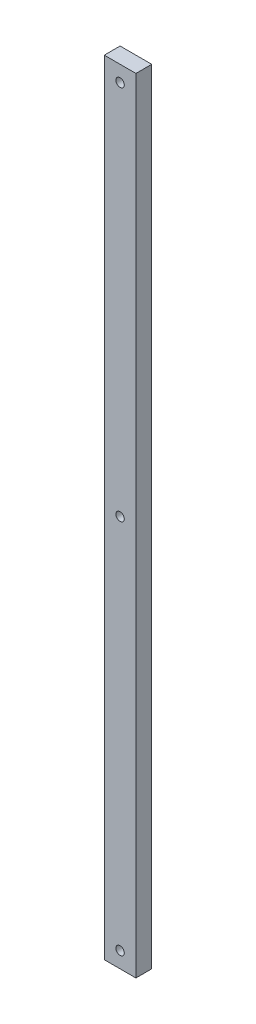
from build123d import *

# Parameters (mm, degrees)
SKETCH1_W           = 25.4
SKETCH1_H           = 628.65
BOSS_EXTRUDE1_DEPTH = 12.7
SKETCH2_R           = 3.3655
CUT_EXTRUDE1_DEPTH  = 630.291087256
LPATTERN1_COUNT     = 3
LPATTERN1_PITCH     = 301.625


with BuildPart() as part:
    # Sketch1 → Boss-Extrude1 (new body)
    with BuildSketch(Plane.XY):
        with Locations((-12.7, 314.325)):
            Rectangle(SKETCH1_W, SKETCH1_H)
    extrude(amount=BOSS_EXTRUDE1_DEPTH)

    # Sketch2 → Cut-Extrude1 (cut, through all)
    with BuildSketch(Plane.XY.offset(12.7)):
        with Locations((-12.7, 12.7)):
            Circle(SKETCH2_R)
    cut_extrude1 = extrude(amount=-CUT_EXTRUDE1_DEPTH, mode=Mode.SUBTRACT)

    # LPattern1: Cut-Extrude1 ×3
    with Locations(*[(0, i * LPATTERN1_PITCH, 0) for i in range(1, LPATTERN1_COUNT)]):
        add(cut_extrude1, mode=Mode.SUBTRACT)


solid = part.part
